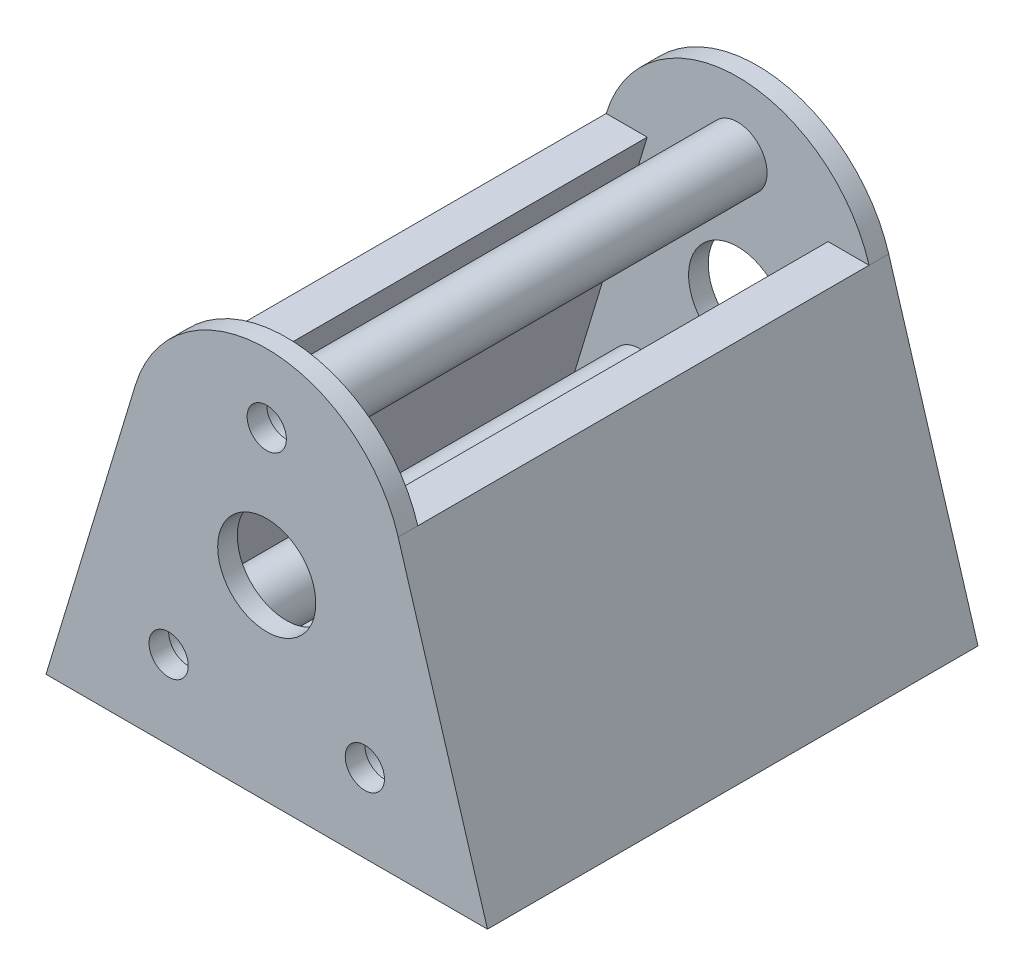
from build123d import *

# Parameters (mm, degrees)
SKETCH1_R           = 5
SKETCH1_R_2         = 2
BOSS_EXTRUDE1_DEPTH = 2
SKETCH2_R           = 2
SKETCH2_R_2         = 5
BOSS_EXTRUDE2_DEPTH = 2
SKETCH3_R           = 3
SKETCH3_R_2         = 2.5
BOSS_EXTRUDE3_DEPTH = 46
BOSS_EXTRUDE4_DEPTH = 46
BOSS_EXTRUDE5_DEPTH = 46
SKETCH8_R           = 5
SKETCH8_R_2         = 2.5
BOSS_EXTRUDE6_DEPTH = 5


with BuildPart() as part:
    # Sketch1 → Boss-Extrude1 (new body)
    with BuildSketch(Plane.XY):
        with BuildLine():
            Line((-22.5, 0), (22.5, 0))
            Line((22.5, 0), (13.399264765, 30.057056046))
            ThreePointArc((13.399264765, 30.057056046), (0, 40), (-13.399264765, 30.057056046))
            Line((-13.399264765, 30.057056046), (-22.5, 0))
        make_face()
        with Locations((0, 20)):
            Circle(SKETCH1_R, mode=Mode.SUBTRACT)
        with Locations((0, 33)):
            Circle(SKETCH1_R_2, mode=Mode.SUBTRACT)
        with Locations((10, 8)):
            Circle(SKETCH1_R_2, mode=Mode.SUBTRACT)
        with Locations((-10, 8)):
            Circle(SKETCH1_R_2, mode=Mode.SUBTRACT)
    extrude(amount=BOSS_EXTRUDE1_DEPTH)



with BuildPart() as body_2:
    # Sketch2 → Boss-Extrude2 (new body)
    with BuildSketch(Plane(origin=(0, 0, 50), x_dir=(-1, 0, 0), z_dir=(0, 0, -1))):
        with BuildLine():
            Line((-13.399264765, 30.057056046), (-22.5, 0))
            Line((-22.5, 0), (22.5, 0))
            Line((22.5, 0), (13.399264765, 30.057056046))
            ThreePointArc((13.399264765, 30.057056046), (0, 40), (-13.399264765, 30.057056046))
        make_face()
        with Locations(Location((-10, 8, 0), (0, 0, 180))):
            Circle(SKETCH2_R, mode=Mode.SUBTRACT)
        with Locations(Location((10, 8, 0), (0, 0, 180))):
            Circle(SKETCH2_R, mode=Mode.SUBTRACT)
        with Locations(Location((0, 20, 0), (0, 0, 180))):
            Circle(SKETCH2_R_2, mode=Mode.SUBTRACT)
        with Locations(Location((0, 33, 0), (0, 0, 180))):
            Circle(SKETCH2_R, mode=Mode.SUBTRACT)
    extrude(amount=BOSS_EXTRUDE2_DEPTH)


with BuildPart() as part_1:
    add(part.part)

    add(body_2.part)  # Boss-Extrude3 merges body 2
    # Sketch3 → Boss-Extrude3 (add)
    # profile 1 of 3: a face of its own
    with BuildSketch(Plane(origin=(0, 0, 48), x_dir=(-1, 0, 0), z_dir=(0, 0, -1))):
        with Locations(Location((10, 8, 0), (0, 0, 180))):
            Circle(SKETCH3_R)
        with Locations(Location((10, 8, 0), (0, 0, 180))):
            Circle(SKETCH3_R_2, mode=Mode.SUBTRACT)
    # profile 2 of 3: a face of its own
    with BuildSketch(Plane(origin=(0, 0, 48), x_dir=(-1, 0, 0), z_dir=(0, 0, -1))):
        with Locations(Location((0, 33, 0), (0, 0, 180))):
            Circle(SKETCH3_R)
        with Locations(Location((0, 33, 0), (0, 0, 180))):
            Circle(SKETCH3_R_2, mode=Mode.SUBTRACT)
    # profile 3 of 3: a face of its own
    with BuildSketch(Plane(origin=(0, 0, 48), x_dir=(-1, 0, 0), z_dir=(0, 0, -1))):
        with Locations(Location((-10, 8, 0), (0, 0, 180))):
            Circle(SKETCH3_R)
        with Locations(Location((-10, 8, 0), (0, 0, 180))):
            Circle(SKETCH3_R_2, mode=Mode.SUBTRACT)
    extrude(amount=BOSS_EXTRUDE3_DEPTH)

    # Sketch4 → Boss-Extrude4 (add)
    with BuildSketch(Plane(origin=(0, 0, 48), x_dir=(-1, 0, 0), z_dir=(0, 0, -1))):
        Polygon((22.5, 0), (-22.5, 0), (-21.288872041, 4), (21.288872041, 4), align=None)
    extrude(amount=BOSS_EXTRUDE4_DEPTH)

    # Sketch5 → Boss-Extrude5 (add)
    with BuildSketch(Plane(origin=(0, 0, 48), x_dir=(-1, 0, 0), z_dir=(0, 0, -1))):
        Polygon((17.109538251, 4), (21.288872041, 4), (13.399264765, 30.057056046), (9.219930974, 30.057056046), align=None)
        Polygon((-21.288872041, 4), (-17.109538251, 4), (-9.219930974, 30.057056046), (-13.399264765, 30.057056046), align=None)
    extrude(amount=BOSS_EXTRUDE5_DEPTH)

    # Sketch8 → Boss-Extrude6 (add)
    # profile 1 of 4: a face of its own
    with BuildSketch(Plane.XZ):
        with Locations(Location((-11.25, 12.5, 0), (0, 0, 90))):
            Circle(SKETCH8_R)
        with Locations(Location((-11.25, 12.5, 0), (0, 0, 270))):
            Circle(SKETCH8_R_2, mode=Mode.SUBTRACT)
    # profile 2 of 4: a face of its own
    with BuildSketch(Plane.XZ):
        with Locations(Location((-11.25, 37.5, 0), (0, 0, 90))):
            Circle(SKETCH8_R)
        with Locations(Location((-11.25, 37.5, 0), (0, 0, 90))):
            Circle(SKETCH8_R_2, mode=Mode.SUBTRACT)
    # profile 3 of 4: a face of its own
    with BuildSketch(Plane.XZ):
        with Locations(Location((11.25, 37.5, 0), (0, 0, 90))):
            Circle(SKETCH8_R)
        with Locations(Location((11.25, 37.5, 0), (0, 0, 270))):
            Circle(SKETCH8_R_2, mode=Mode.SUBTRACT)
    # profile 4 of 4: a face of its own
    with BuildSketch(Plane.XZ):
        with Locations(Location((11.25, 12.5, 0), (0, 0, 90))):
            Circle(SKETCH8_R)
        with Locations(Location((11.25, 12.5, 0), (0, 0, 90))):
            Circle(SKETCH8_R_2, mode=Mode.SUBTRACT)
    extrude(amount=BOSS_EXTRUDE6_DEPTH)


solid = part_1.part
